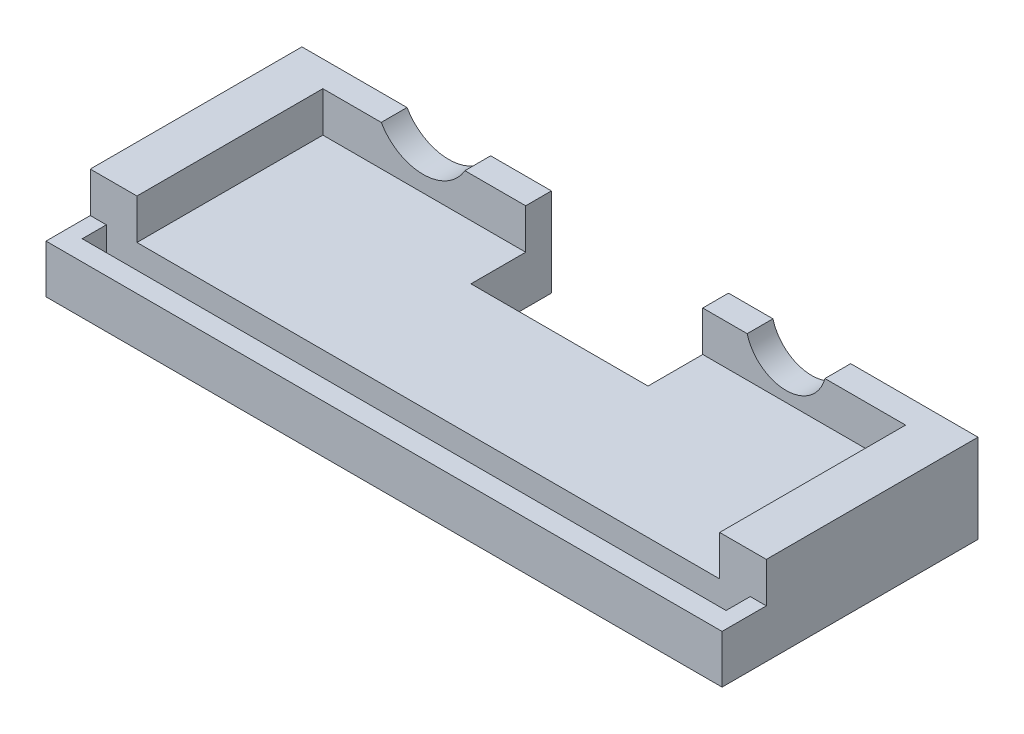
from build123d import *

# Parameters (mm, degrees)
SKETCH_1_W          = 84
SKETCH_1_H          = 31.8
EXTRUDE_1_DEPTH     = 6
SKETCH_2_W          = 80
SKETCH_2_H          = 3
CUT_EXTRUDE_1_DEPTH = 3
EXTRUDE_2_DEPTH     = 5
SKETCH_4_R          = 5
SKETCH_4_R_2        = 6
CUT_EXTRUDE_2_DEPTH = 91.488894346
SKETCH_3_3_W        = 22
SKETCH_3_3_H        = 10
CUT_EXTRUDE_3_DEPTH = 91.0179982


with BuildPart() as part:
    # 草图1 → 凸台-拉伸1 (new body)
    with BuildSketch(Plane(origin=(0, 0, 0), x_dir=(1, 0, 0), z_dir=(0, 1, 0))):
        with Locations((42, -15.9)):
            Rectangle(SKETCH_1_W, SKETCH_1_H)
    extrude(amount=EXTRUDE_1_DEPTH)

    # 草图2 → 切除-拉伸1 (cut)
    with BuildSketch(Plane(origin=(0, 6, 0), x_dir=(1, 0, 0), z_dir=(0, 1, 0))):
        with Locations((42, -27.8)):
            Rectangle(SKETCH_2_W, SKETCH_2_H)
    extrude(amount=-CUT_EXTRUDE_1_DEPTH, mode=Mode.SUBTRACT)

    # 草图3 → 凸台-拉伸2 (add)
    with BuildSketch(Plane(origin=(0, 6, 0), x_dir=(1, 0, 0), z_dir=(0, 1, 0))):
        Polygon((31, 0), (0, 0), (0, -26.3), (5.8, -26.3), (5.8, -3.2), (31, -3.2), align=None)
        Polygon((84, 0), (53, 0), (53, -3.2), (78.2, -3.2), (78.2, -26.3), (84, -26.3), align=None)
    extrude(amount=EXTRUDE_2_DEPTH)

    # 草图4 → 切除-拉伸2 (cut, through all)
    with BuildSketch(Plane(origin=(0, 0, 0), x_dir=(-1, 0, 0), z_dir=(0, 0, -1))):
        with Locations((-63.35, 12.3)):
            Circle(SKETCH_4_R)
        with Locations((-18.25, 14)):
            Circle(SKETCH_4_R_2)
    extrude(amount=-CUT_EXTRUDE_2_DEPTH, mode=Mode.SUBTRACT)

    # 草图3<3> → 切除-拉伸3 (cut, through all)
    with BuildSketch(Plane(origin=(0, 6, 0), x_dir=(1, 0, 0), z_dir=(0, 1, 0))):
        with Locations((42, -5)):
            Rectangle(SKETCH_3_3_W, SKETCH_3_3_H)
    extrude(amount=-CUT_EXTRUDE_3_DEPTH, mode=Mode.SUBTRACT)


solid = part.part
